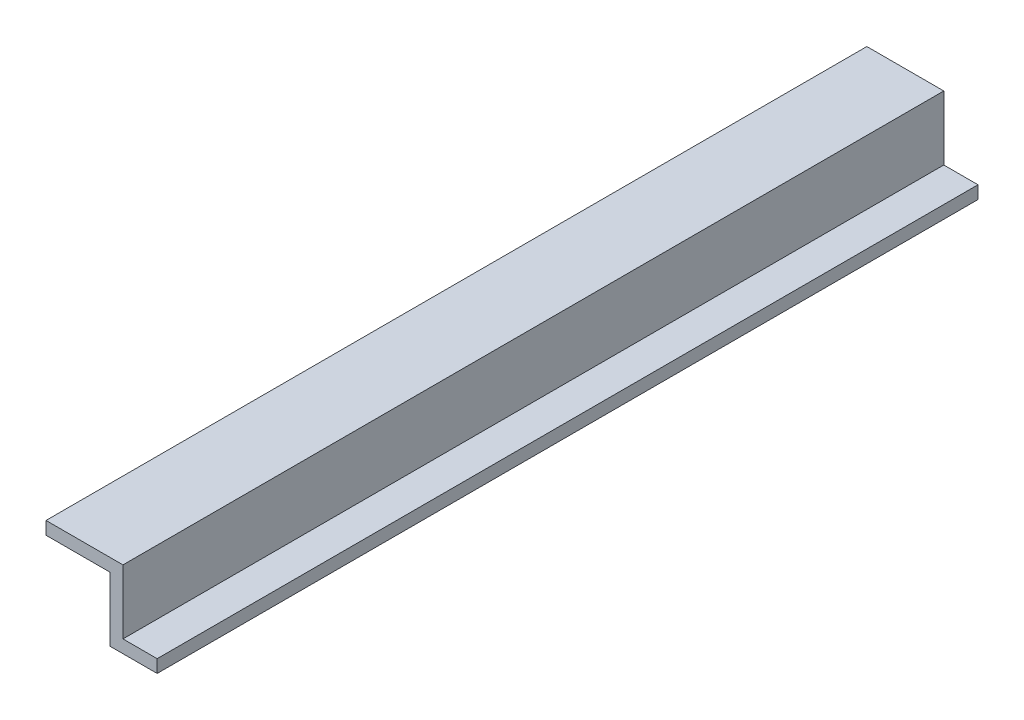
from build123d import *

# Parameters (mm, degrees)
BOSS_EXTRUDE1_DEPTH      = 152.4
BOSS_EXTRUDE1_DEPTH_BACK = 152.4


with BuildPart() as part:
    # Sketch3 → Boss-Extrude1 (new, two sides: drawn at the far end of the back side and taken through both)
    with BuildSketch(Plane.XY.offset(-BOSS_EXTRUDE1_DEPTH_BACK)):
        Polygon((15.08125, -9.525), (15.08125, -14.2875), (-2.38125, -14.2875), (-2.38125, 9.525), (-26.19375, 9.525), (-26.19375, 14.2875), (2.38125, 14.2875), (2.38125, -9.525), align=None)
    extrude(amount=BOSS_EXTRUDE1_DEPTH + BOSS_EXTRUDE1_DEPTH_BACK)


solid = part.part
